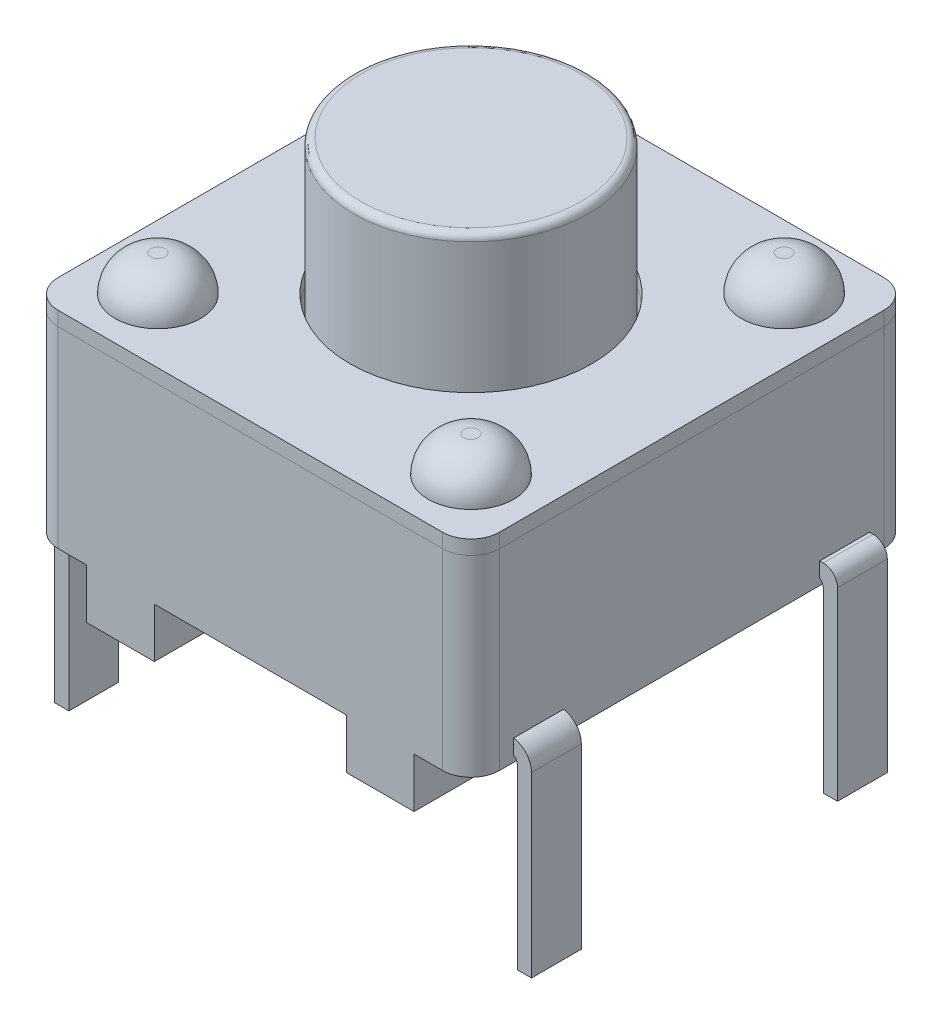
from build123d import *

# Parameters (mm, degrees)
SKETCH1_W                = 6.2
SKETCH1_H                = 6.2
BOSS_EXTRUDE1_DEPTH      = 3.6
CUT_EXTRUDE1_DEPTH       = 6.672741841
CUT_EXTRUDE1_DEPTH_BACK  = 6.672741841
SKETCH2_W                = 2
SKETCH2_H                = 0.7
CUT_EXTRUDE2_DEPTH       = 6.672741841
CUT_EXTRUDE2_DEPTH_BACK  = 6.672741841
SKETCH4_W                = 2.7
SKETCH4_H                = 0.7
SKETCH4_W_2              = 0.8
FILLET1_R                = 0.4
SPLIT1_SURFACE_1_BACK    = 10.478
SPLIT1_SURFACE_1_DEPTH   = 20.956
SPLIT1_SURFACE_2_BACK    = 10.478
SPLIT1_SURFACE_2_DEPTH   = 20.956
SKETCH6_R                = 0.6
CUT_EXTRUDE3_DEPTH       = 6.672741841
BOSS_EXTRUDE3_DEPTH      = 0.5
BOSS_EXTRUDE3_DEPTH_BACK = 0.2
SKETCH6_2_R              = 0.6
FILLET2_R                = 0.5
SKETCH7_R                = 1.7
CUT_EXTRUDE4_DEPTH       = 2.4
SKETCH8_R                = 1.65
BOSS_EXTRUDE4_DEPTH      = 4.3
FILLET3_R                = 0.1
SKETCH9_W                = 0.7
SKETCH9_H                = 2.8
BOSS_EXTRUDE5_DEPTH      = 3.35
BOSS_EXTRUDE5_2_DEPTH    = 3.35
FILLET4_R                = 0.3
FILLET5_R                = 0.2
CUT_EXTRUDE5_DEPTH       = 8.14720225
CUT_EXTRUDE5_DEPTH_BACK  = 8.14720225


with BuildPart() as part:
    # Sketch1 → Boss-Extrude1 (new body)
    with BuildSketch(Plane(origin=(0, 0, 0), x_dir=(1, 0, 0), z_dir=(0, 1, 0))):
        Rectangle(SKETCH1_W, SKETCH1_H)
    extrude(amount=BOSS_EXTRUDE1_DEPTH)

    # Sketch2 → Cut-Extrude1 (cut, two sides: drawn at the far end of the back side and taken through both)
    with BuildSketch(Plane(origin=(0, 0, 0), x_dir=(0, 0, -1), z_dir=(1, 0, 0)).offset(-CUT_EXTRUDE1_DEPTH_BACK)):
        with Locations((0, 0.35)):
            Rectangle(SKETCH2_W, SKETCH2_H)
    extrude(amount=CUT_EXTRUDE1_DEPTH + CUT_EXTRUDE1_DEPTH_BACK, mode=Mode.SUBTRACT)

    # Sketch4 → Cut-Extrude2 (cut, two sides: drawn at the far end of the back side and taken through both)
    with BuildSketch(Plane.XY.offset(-CUT_EXTRUDE2_DEPTH_BACK)):
        with Locations((0, 0.35)):
            Rectangle(SKETCH4_W, SKETCH4_H)
        with Locations((2.7, 0.35)):
            Rectangle(SKETCH4_W_2, SKETCH4_H)
        with Locations((-2.7, 0.35)):
            Rectangle(SKETCH4_W_2, SKETCH4_H)
    extrude(amount=CUT_EXTRUDE2_DEPTH + CUT_EXTRUDE2_DEPTH_BACK, mode=Mode.SUBTRACT)

    # Fillet1
    fillet1_edges = [part.edges().sort_by_distance(p)[0] for p in [
        (3.1, 2.15, 3.1),
        (-3.1, 2.15, 3.1),
        (-3.1, 2.15, -3.1),
        (3.1, 2.15, -3.1),
    ]]
    fillet(fillet1_edges, radius=FILLET1_R)


with BuildPart() as body_2:
    # Split1: the piece behind the surface
    add(part.part)
    # Split1 surface: a surface, the sketch's curves swept straight by 20.956 mm
    with BuildLine(Plane.XY.offset(-SPLIT1_SURFACE_1_BACK), mode=Mode.PRIVATE) as split1_surface_1_path:
        Line((-3.1, 3.4), (3.1, 3.4))
    split1_surface_1 = Shell.extrude(split1_surface_1_path.wire(), (0 * SPLIT1_SURFACE_1_DEPTH, 0 * SPLIT1_SURFACE_1_DEPTH, 1 * SPLIT1_SURFACE_1_DEPTH))
    split(bisect_by=split1_surface_1, keep=Keep.BOTTOM)

    # Sketch6<2> → Boss-Extrude3 (add, two sides: drawn at the far end of the back side and taken through both)
    with BuildSketch(Plane(origin=(0, 3.6, 0), x_dir=(1, 0, 0), z_dir=(0, 1, 0)).offset(-BOSS_EXTRUDE3_DEPTH_BACK)):
        with Locations(Location((-2.2, 2.2, 0), (0, 0, 270))):
            Circle(SKETCH6_2_R)
        with Locations(Location((2.2, 2.2, 0), (0, 0, 270))):
            Circle(SKETCH6_2_R)
        with Locations(Location((-2.2, -2.2, 0), (0, 0, 270))):
            Circle(SKETCH6_2_R)
        with Locations(Location((2.2, -2.2, 0), (0, 0, 270))):
            Circle(SKETCH6_2_R)
    extrude(amount=BOSS_EXTRUDE3_DEPTH + BOSS_EXTRUDE3_DEPTH_BACK)

    # Fillet2
    fillet2_edges = [body_2.edges().sort_by_distance(p)[0] for p in [
        (-2.2, 4.1, -2.8),
        (2.2, 4.1, -2.8),
        (-2.2, 4.1, 1.6),
        (2.2, 4.1, 1.6),
    ]]
    fillet(fillet2_edges, radius=FILLET2_R)


with BuildPart() as part_1:
    add(part.part)

    # Split1: split by a surface, the side it looks to stays
    # Split1 surface: a surface, the sketch's curves swept straight by 20.956 mm
    with BuildLine(Plane.XY.offset(-SPLIT1_SURFACE_2_BACK), mode=Mode.PRIVATE) as split1_surface_2_path:
        Line((-3.1, 3.4), (3.1, 3.4))
    split1_surface_2 = Shell.extrude(split1_surface_2_path.wire(), (0 * SPLIT1_SURFACE_2_DEPTH, 0 * SPLIT1_SURFACE_2_DEPTH, 1 * SPLIT1_SURFACE_2_DEPTH))
    split(bisect_by=split1_surface_2, keep=Keep.TOP)

    # Sketch6 → Cut-Extrude3 (cut, through all)
    with BuildSketch(Plane(origin=(0, 3.6, 0), x_dir=(1, 0, 0), z_dir=(0, 1, 0))):
        with Locations(Location((-2.2, 2.2, 0), (0, 0, 270))):
            Circle(SKETCH6_R)
        with Locations(Location((2.2, 2.2, 0), (0, 0, 270))):
            Circle(SKETCH6_R)
        with Locations(Location((-2.2, -2.2, 0), (0, 0, 270))):
            Circle(SKETCH6_R)
        with Locations(Location((2.2, -2.2, 0), (0, 0, 270))):
            Circle(SKETCH6_R)
    extrude(amount=-CUT_EXTRUDE3_DEPTH, mode=Mode.SUBTRACT)


with BuildPart() as cut_extrude4_tool:
    # Sketch7 → Cut-Extrude4 (new body)
    with BuildSketch(Plane(origin=(0, 3.6, 0), x_dir=(1, 0, 0), z_dir=(0, 1, 0))):
        with Locations(Location((0, 0, 0), (0, 0, 270))):
            Circle(SKETCH7_R)
    extrude(amount=-CUT_EXTRUDE4_DEPTH)


with BuildPart() as part_2:
    add(part_1.part)

    # Cut-Extrude4: cut by cut_extrude4_tool
    add(cut_extrude4_tool.part, mode=Mode.SUBTRACT)


with BuildPart() as body_2_1:
    add(body_2.part)

    # Cut-Extrude4: cut by cut_extrude4_tool
    add(cut_extrude4_tool.part, mode=Mode.SUBTRACT)


with BuildPart() as body_3:
    # Sketch8 → Boss-Extrude4 (new body)
    with BuildSketch(Plane(origin=(0, 1.2, 0), x_dir=(1, 0, 0), z_dir=(0, 1, 0))):
        with Locations(Location((0, 0, 0), (0, 0, 270))):
            Circle(SKETCH8_R)
    extrude(amount=BOSS_EXTRUDE4_DEPTH)

    # Fillet3
    fillet3_edges = [body_3.edges().sort_by_distance(p)[0] for p in [
        (0, 5.5, -1.65),
    ]]
    fillet(fillet3_edges, radius=FILLET3_R)


with BuildPart() as body_4:
    # Sketch9 → Boss-Extrude5 (new, symmetric)
    with BuildSketch(Plane(origin=(0, 0, 0), x_dir=(0, 0, -1), z_dir=(1, 0, 0))):
        with Locations((2.15, -0.4)):
            Rectangle(SKETCH9_W, SKETCH9_H)
    extrude(amount=BOSS_EXTRUDE5_DEPTH, both=True)

    # Fillet5
    fillet5_edges = [body_4.edges().sort_by_distance(p)[0] for p in [
        (3.35, 1, -2.15),
        (-3.35, 1, -2.15),
    ]]
    fillet(fillet5_edges, radius=FILLET5_R)


with BuildPart() as body_5:
    # Sketch9 → Boss-Extrude5 2 (new, symmetric)
    with BuildSketch(Plane(origin=(0, 0, 0), x_dir=(0, 0, -1), z_dir=(1, 0, 0))):
        with Locations((-2.15, -0.4)):
            Rectangle(SKETCH9_W, SKETCH9_H)
    extrude(amount=BOSS_EXTRUDE5_2_DEPTH, both=True)

    # Fillet4
    fillet4_edges = [body_5.edges().sort_by_distance(p)[0] for p in [
        (3.35, 1, 2.15),
        (-3.35, 1, 2.15),
    ]]
    fillet(fillet4_edges, radius=FILLET4_R)


with BuildPart() as cut_extrude5_tool:
    # Sketch11 → Cut-Extrude5 (new, two sides: drawn at the far end of the back side and taken through both)
    with BuildSketch(Plane.XY.offset(-CUT_EXTRUDE5_DEPTH_BACK)):
        with BuildLine():
            Line((3.05, 0.8), (-3.05, 0.8))
            ThreePointArc((-3.05, 0.8), (-3.120710678, 0.770710678), (-3.15, 0.7))
            Line((-3.15, 0.7), (-3.15, -1.8))
            Line((-3.15, -1.8), (3.15, -1.8))
            Line((3.15, -1.8), (3.15, 0.7))
            ThreePointArc((3.15, 0.7), (3.120710678, 0.770710678), (3.05, 0.8))
        make_face()
    extrude(amount=CUT_EXTRUDE5_DEPTH + CUT_EXTRUDE5_DEPTH_BACK)


with BuildPart() as body_5_1:
    add(body_5.part)

    # Cut-Extrude5: cut by cut_extrude5_tool
    add(cut_extrude5_tool.part, mode=Mode.SUBTRACT)


with BuildPart() as body_4_1:
    add(body_4.part)

    # Cut-Extrude5: cut by cut_extrude5_tool
    add(cut_extrude5_tool.part, mode=Mode.SUBTRACT)


solid = Compound([part_2.part, body_2_1.part, body_3.part, body_5_1.part, body_4_1.part])
